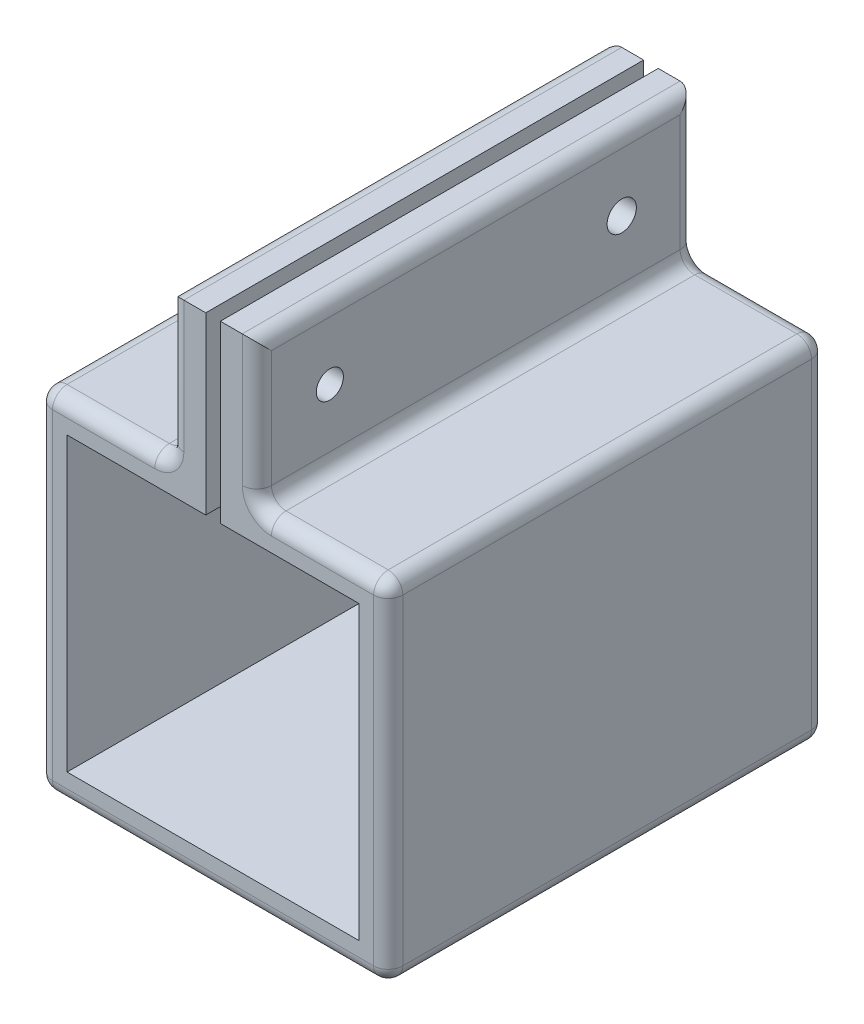
from build123d import *

# Parameters (mm, degrees)
SKETCH_1_W          = 6
SKETCH_1_H          = 2
SKETCH_1_H_2        = 10
EXTRUDE_1_DEPTH     = 30
SKETCH_2_W          = 1
SKETCH_2_H          = 17.803492696
CUT_EXTRUDE_1_DEPTH = 30
SKETCH_3_R          = 1.003337712
SKETCH_3_R_2        = 0.930822741
CUT_EXTRUDE_2_DEPTH = 30
FILLET_1_R          = 1


with BuildPart() as part:
    # 草图1 → 凸台-拉伸1 (new body)
    with BuildSketch(Plane.XY):
        with Locations((0, 11)):
            Rectangle(SKETCH_1_W, SKETCH_1_H)
        Polygon((-10, -10), (-10, 10), (-3, 10), (-3, 12), (-12, 12), (-12, -12), (12, -12), (12, 12), (3, 12), (3, 10), (10, 10), (10, -10), align=None)
        with Locations((0, 17)):
            Rectangle(SKETCH_1_W, SKETCH_1_H_2)
    extrude(amount=EXTRUDE_1_DEPTH)

    # 草图2 → 切除-拉伸1 (cut)
    with BuildSketch(Plane.XY.offset(30)):
        with Locations((0, 18.381427763)):
            Rectangle(SKETCH_2_W, SKETCH_2_H)
    extrude(amount=-CUT_EXTRUDE_1_DEPTH, mode=Mode.SUBTRACT)

    # 草图3 → 切除-拉伸2 (cut)
    with BuildSketch(Plane.ZY.offset(3)):
        with Locations(Location((5, 17, 0), (0, 0, 90))):
            Circle(SKETCH_3_R)
        with Locations(Location((25, 17, 0), (0, 0, 90))):
            Circle(SKETCH_3_R_2)
    extrude(amount=-CUT_EXTRUDE_2_DEPTH, mode=Mode.SUBTRACT)

    # 圆角1
    fillet_1_edges = [part.edges().sort_by_distance(p)[0] for p in [
        (12, 0, 0),
        (0, -12, 0),
        (-12, 0, 0),
        (-7.5, 12, 0),
        (-3, 17, 0),
        (3, 17, 0),
        (7.5, 12, 0),
        (12, 12, 15),
        (12, -12, 15),
        (-12, -12, 15),
        (-12, 12, 15),
        (-3, 12, 15),
        (-3, 22, 15),
        (3, 22, 15),
        (3, 12, 15),
        (7.5, 12, 30),
        (3, 17, 30),
        (-3, 17, 30),
        (-7.5, 12, 30),
        (-12, 0, 30),
        (0, -12, 30),
        (12, 0, 30),
    ]]
    fillet(fillet_1_edges, radius=FILLET_1_R)


solid = part.part
